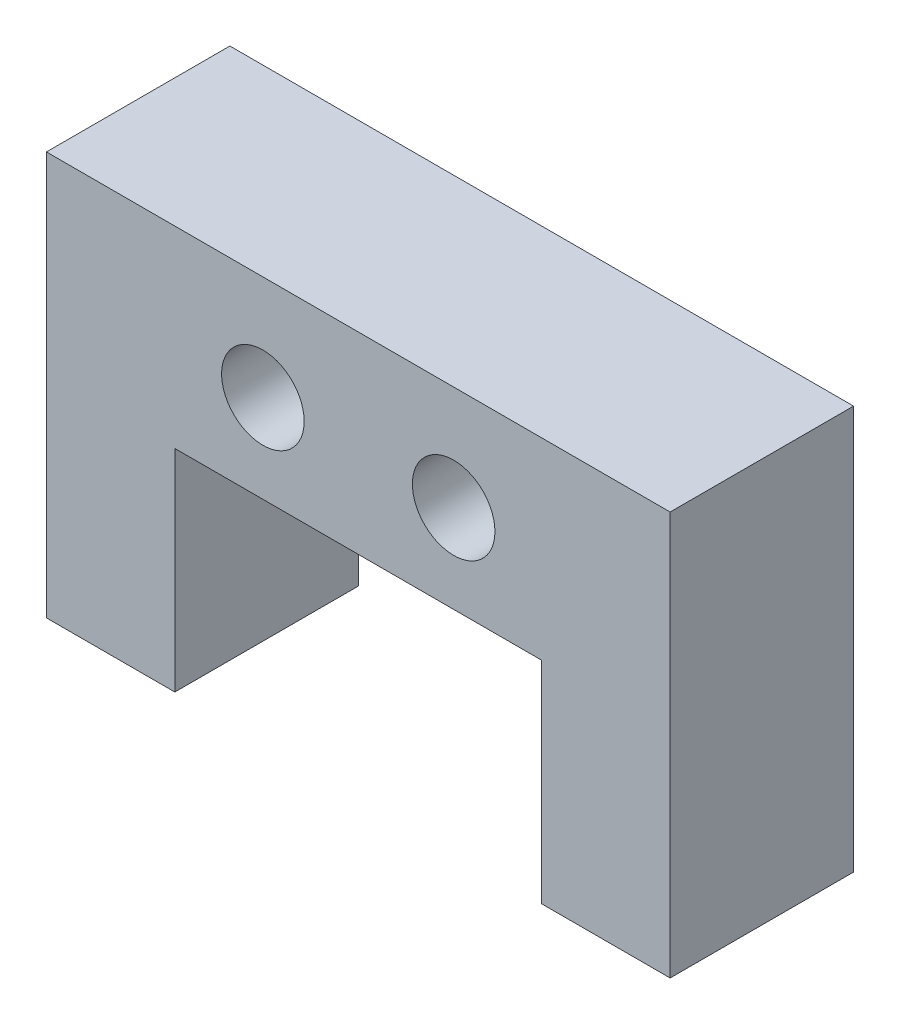
from build123d import *

# Parameters (mm, degrees)
SKETCH1_R           = 2.25
BOSS_EXTRUDE1_DEPTH = 10


with BuildPart() as part:
    # Sketch1 → Boss-Extrude1 (new body)
    with BuildSketch(Plane.XY):
        Polygon((27, 0), (34, 0), (34, 22), (0, 22), (0, 0), (7, 0), (7, 11.5), (27, 11.5), align=None)
        with Locations((22.2, 16.3)):
            Circle(SKETCH1_R, mode=Mode.SUBTRACT)
        with Locations((11.8, 16.3)):
            Circle(SKETCH1_R, mode=Mode.SUBTRACT)
    extrude(amount=BOSS_EXTRUDE1_DEPTH)


solid = part.part
